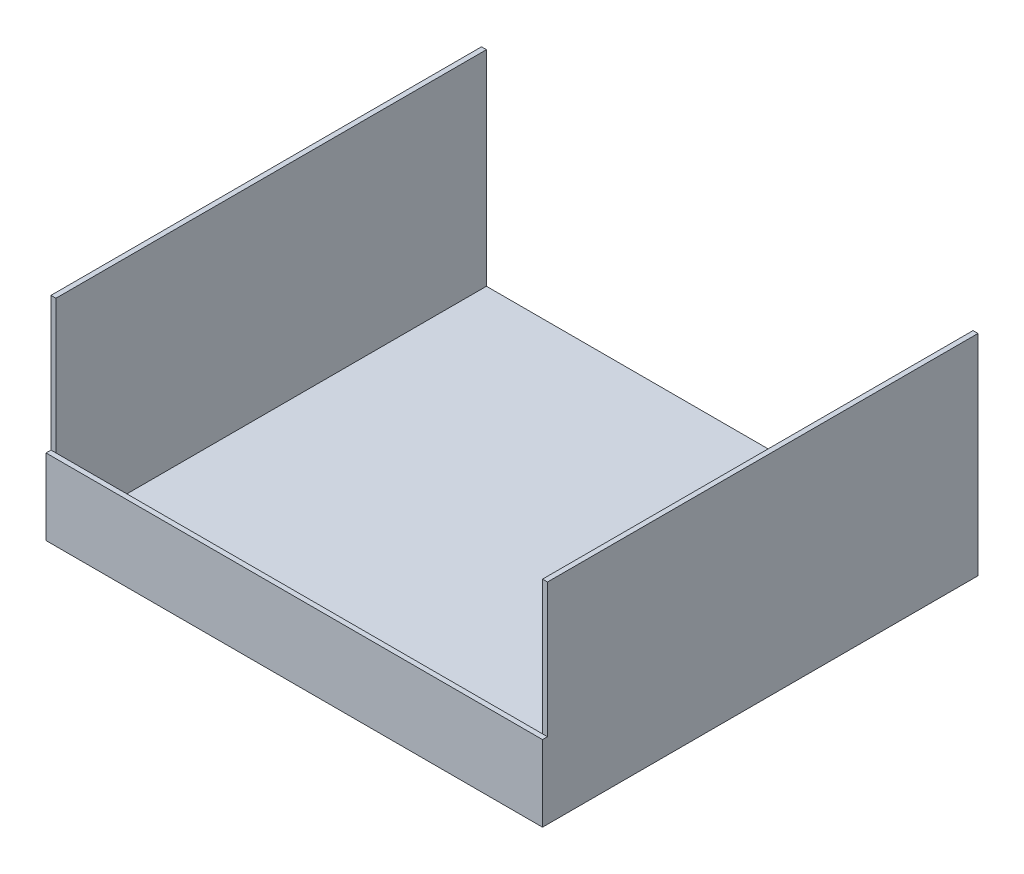
from build123d import *

# Parameters (mm, degrees)
SKETCH2_W           = 200.025
SKETCH2_H           = 175.45
BOSS_EXTRUDE1_DEPTH = 2
SKETCH3_W           = 2
SKETCH3_H           = 173.45
BOSS_EXTRUDE2_DEPTH = 82.55
SKETCH4_W           = 200.025
SKETCH4_H           = 2
BOSS_EXTRUDE4_DEPTH = 28.575


with BuildPart() as part:
    # Sketch2 → Boss-Extrude1 (new body)
    with BuildSketch(Plane(origin=(0, 0, 0), x_dir=(1, 0, 0), z_dir=(0, 1, 0))):
        with Locations((-11.312041544, 46.007841651)):
            Rectangle(SKETCH2_W, SKETCH2_H)
    extrude(amount=BOSS_EXTRUDE1_DEPTH)

    # Sketch3 → Boss-Extrude2 (add)
    with BuildSketch(Plane(origin=(0, 2, 0), x_dir=(1, 0, 0), z_dir=(0, 1, 0))):
        with Locations((-110.324541544, 47.007841651)):
            Rectangle(SKETCH3_W, SKETCH3_H)
        with Locations((87.700458456, 47.007841651)):
            Rectangle(SKETCH3_W, SKETCH3_H)
    extrude(amount=BOSS_EXTRUDE2_DEPTH)

    # Sketch4 → Boss-Extrude4 (add)
    with BuildSketch(Plane(origin=(0, 2, 0), x_dir=(1, 0, 0), z_dir=(0, 1, 0))):
        with Locations((-11.312041544, -40.717158349)):
            Rectangle(SKETCH4_W, SKETCH4_H)
    extrude(amount=BOSS_EXTRUDE4_DEPTH)


solid = part.part
